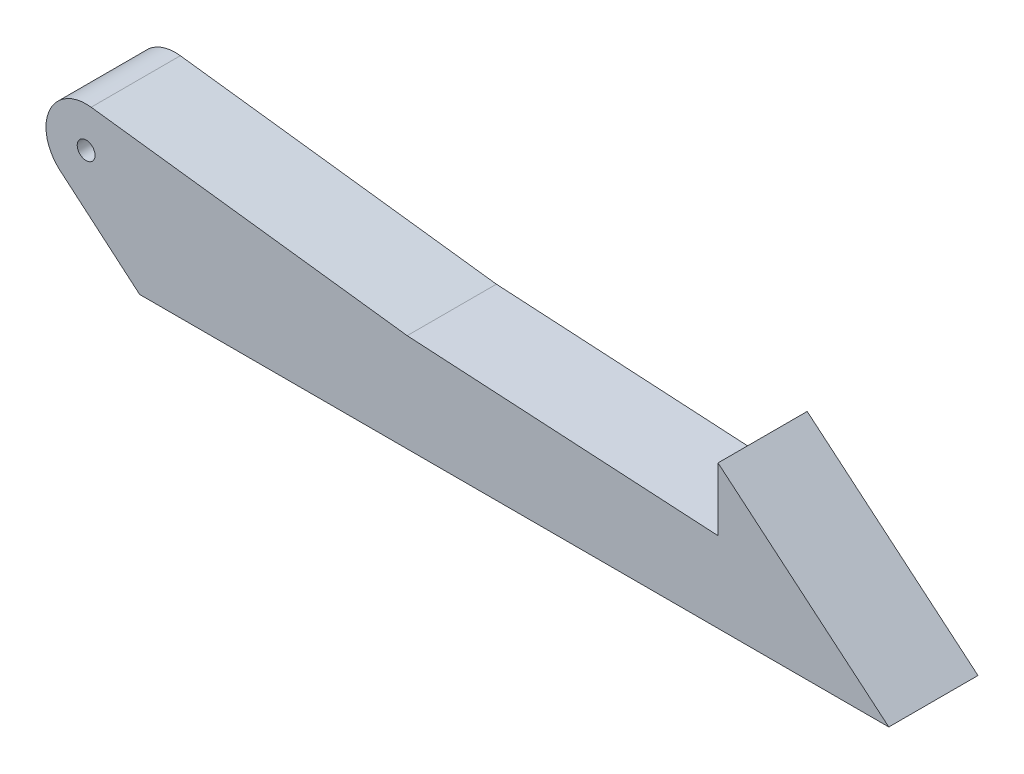
from build123d import *

# Parameters (mm, degrees)
SKETCH3_R           = 1
BOSS_EXTRUDE1_DEPTH = 10


with BuildPart() as part:
    # Sketch3 → Boss-Extrude1 (new body)
    with BuildSketch(Plane.XY):
        with BuildLine():
            Line((0.5625, 4.464705337), (36, 0))
            Line((36, 0), (70.848888922, -2))
            Line((70.848888922, -2), (70.848888922, 5.069690242))
            Line((70.848888922, 5.069690242), (90, -11))
            Line((90, -11), (6, -11))
            Line((6, -11), (-2.91308134, -3.429862549))
            ThreePointArc((-2.91308134, -3.429862549), (-4.118538416, 1.813185405), (0.5625, 4.464705337))
        make_face()
        Circle(SKETCH3_R, mode=Mode.SUBTRACT)
    extrude(amount=BOSS_EXTRUDE1_DEPTH)


solid = part.part
